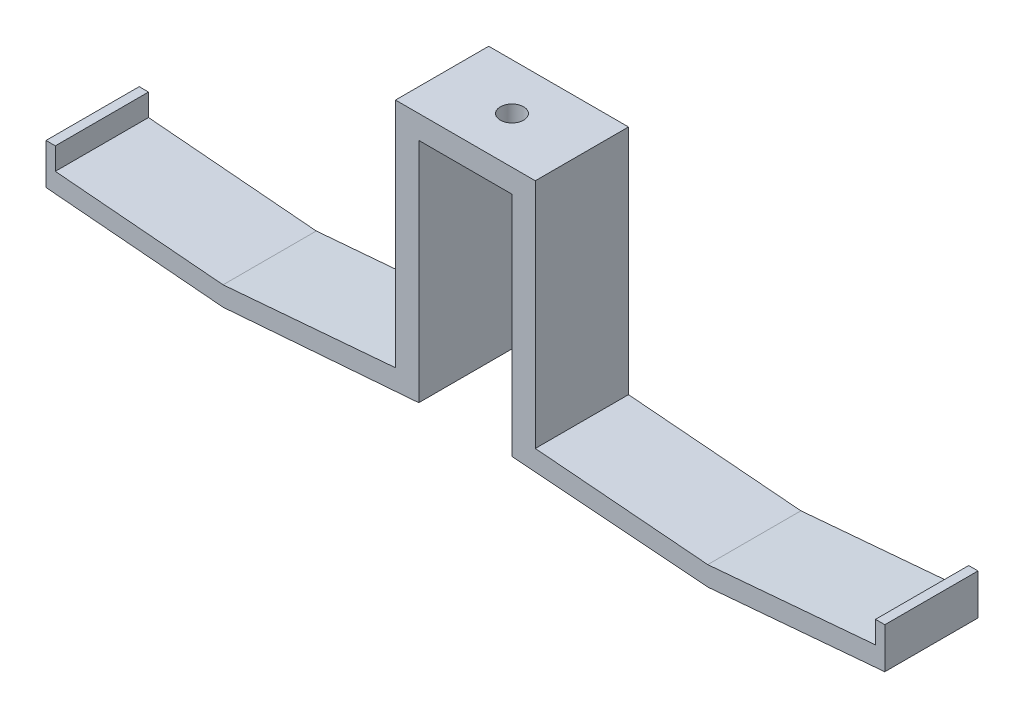
from build123d import *

# Parameters (mm, degrees)
BOSS_EXTRUDE1_DEPTH = 25.4
CUT_EXTRUDE1_REACH  = 139.665
SKETCH3_R           = 3.175


with BuildPart() as part:
    # Sketch2 → Boss-Extrude1 (new body)
    with BuildSketch(Plane.XY):
        Polygon((0, 0), (12.7, 0), (12.7, -61.9179737), (66.04, -66.051353419), (114.3, -61.9179737), (114.3, -50.811353419), (111.76, -50.811353419), (111.76, -56.8379737), (66.04, -60.753807118), (19.05, -56.8379737), (19.05, 0), (19.05, 6.35), (0, 6.35), align=None)
        Polygon((-12.7, 0), (0, 0), (0, 6.35), (-19.05, 6.35), (-19.05, 0), (-19.05, -56.8379737), (-66.04, -60.753807118), (-111.76, -56.8379737), (-111.76, -50.811353419), (-114.3, -50.811353419), (-114.3, -61.9179737), (-66.04, -66.051353419), (-12.7, -61.9179737), align=None)
    extrude(amount=BOSS_EXTRUDE1_DEPTH)

    # Sketch3 → Cut-Extrude1 (cut, up to next)
    with BuildSketch(Plane(origin=(0, 6.35, 0), x_dir=(1, 0, 0), z_dir=(0, 1, 0)), mode=Mode.PRIVATE) as cut_extrude1_sk1:
        with Locations(Location((0, -12.7, 0), (0, 0, 270))):
            Circle(SKETCH3_R)
    cut_extrude1_tool1 = extrude(cut_extrude1_sk1.sketch, amount=-CUT_EXTRUDE1_REACH, mode=Mode.PRIVATE) & part.part
    add(cut_extrude1_tool1.solids().sort_by_distance((0, 6.35, 12.7))[0], mode=Mode.SUBTRACT)


solid = part.part
